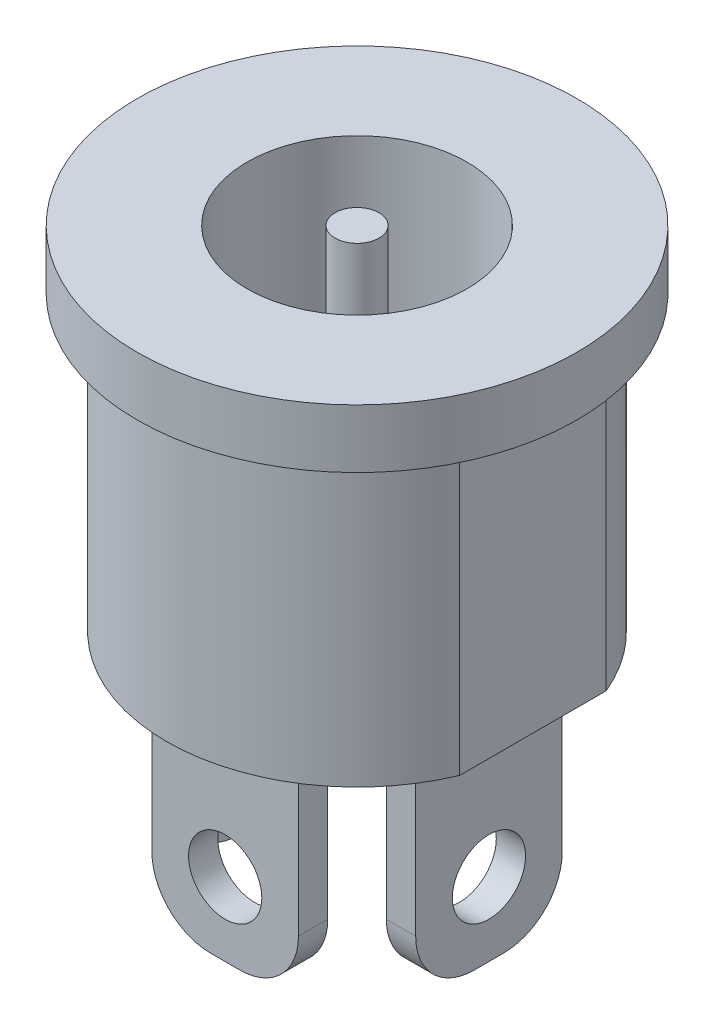
from build123d import *

# Parameters (mm, degrees)
SALIENTE_EXTRUIR1_DEPTH = 10
CROQUIS2_R              = 7.5
SALIENTE_EXTRUIR2_DEPTH = 2
CROQUIS3_R              = 3.75
CROQUIS3_R_2            = 0.75
CORTAR_EXTRUIR1_DEPTH   = 6.5
CROQUIS4_W              = 1
CROQUIS4_H              = 5
CROQUIS4_W_2            = 5
CROQUIS4_H_2            = 1
SALIENTE_EXTRUIR3_DEPTH = 7.5
CORTAR_EXTRUIR2_REACH   = 20.554
CROQUIS5_R              = 1.25
CROQUIS6_R              = 1.25
CORTAR_EXTRUIR3_DEPTH   = 1
REDONDEO1_R             = 2


with BuildPart() as part:
    # Croquis1 → Saliente-Extruir1 (new body)
    with BuildSketch(Plane(origin=(0, 0, 0), x_dir=(1, 0, 0), z_dir=(0, 1, 0))):
        with BuildLine():
            Line((6, 2.5), (6, -2.5))
            ThreePointArc((6, -2.5), (0, -6.5), (-6, -2.5))
            Line((-6, -2.5), (-6, 2.5))
            ThreePointArc((-6, 2.5), (0, 6.5), (6, 2.5))
        make_face()
    extrude(amount=SALIENTE_EXTRUIR1_DEPTH)

    # Croquis2 → Saliente-Extruir2 (add)
    with BuildSketch(Plane(origin=(0, 10, 0), x_dir=(1, 0, 0), z_dir=(0, 1, 0))):
        with Locations(Location((0, 0, 0), (0, 0, 270))):
            Circle(CROQUIS2_R)
    extrude(amount=SALIENTE_EXTRUIR2_DEPTH)

    # Croquis3 → Cortar-Extruir1 (cut)
    with BuildSketch(Plane(origin=(0, 12, 0), x_dir=(1, 0, 0), z_dir=(0, 1, 0))):
        with Locations(Location((0, 0, 0), (0, 0, 270))):
            Circle(CROQUIS3_R)
        with Locations(Location((0, 0, 0), (0, 0, 270))):
            Circle(CROQUIS3_R_2, mode=Mode.SUBTRACT)
    extrude(amount=-CORTAR_EXTRUIR1_DEPTH, mode=Mode.SUBTRACT)

    # Croquis4 → Saliente-Extruir3 (add)
    with BuildSketch(Plane.XZ):
        with Locations((-4, 0)):
            Rectangle(CROQUIS4_W, CROQUIS4_H)
        with Locations((4, 0)):
            Rectangle(CROQUIS4_W, CROQUIS4_H)
        with Locations((0, 4)):
            Rectangle(CROQUIS4_W_2, CROQUIS4_H_2)
    extrude(amount=SALIENTE_EXTRUIR3_DEPTH)

    # Cortar-Extruir2: up to this face of the body (flat: up to its plane)
    cortar_extruir2_end = Plane(part.part.faces().sort_by_distance((4.5, -3.75, 0))[0])
    # Croquis5 → Cortar-Extruir2 (cut, up to the picked face)
    with BuildSketch(Plane.ZY.offset(4.5), mode=Mode.PRIVATE) as cortar_extruir2_sk1:
        with Locations((0, -4.997728335)):
            Circle(CROQUIS5_R)
    cortar_extruir2_tool1 = split(extrude(cortar_extruir2_sk1.sketch, amount=-CORTAR_EXTRUIR2_REACH, mode=Mode.PRIVATE), bisect_by=cortar_extruir2_end, keep=Keep.BOTH, mode=Mode.PRIVATE)
    add(cortar_extruir2_tool1.solids().sort_by(Axis((-4.5, -4.997728, 0), (1, 0, 0)))[0], mode=Mode.SUBTRACT)

    # Croquis6 → Cortar-Extruir3 (cut)
    with BuildSketch(Plane.XY.offset(4.5)):
        with Locations((0, -5)):
            Circle(CROQUIS6_R)
    extrude(amount=-CORTAR_EXTRUIR3_DEPTH, mode=Mode.SUBTRACT)

    # Redondeo1
    redondeo1_edges = [part.edges().sort_by_distance(p)[0] for p in [
        (-4, -7.5, 2.5),
        (-4, -7.5, -2.5),
        (4, -7.5, 2.5),
        (4, -7.5, -2.5),
        (2.5, -7.5, 4),
        (-2.5, -7.5, 4),
    ]]
    fillet(redondeo1_edges, radius=REDONDEO1_R)


solid = part.part
